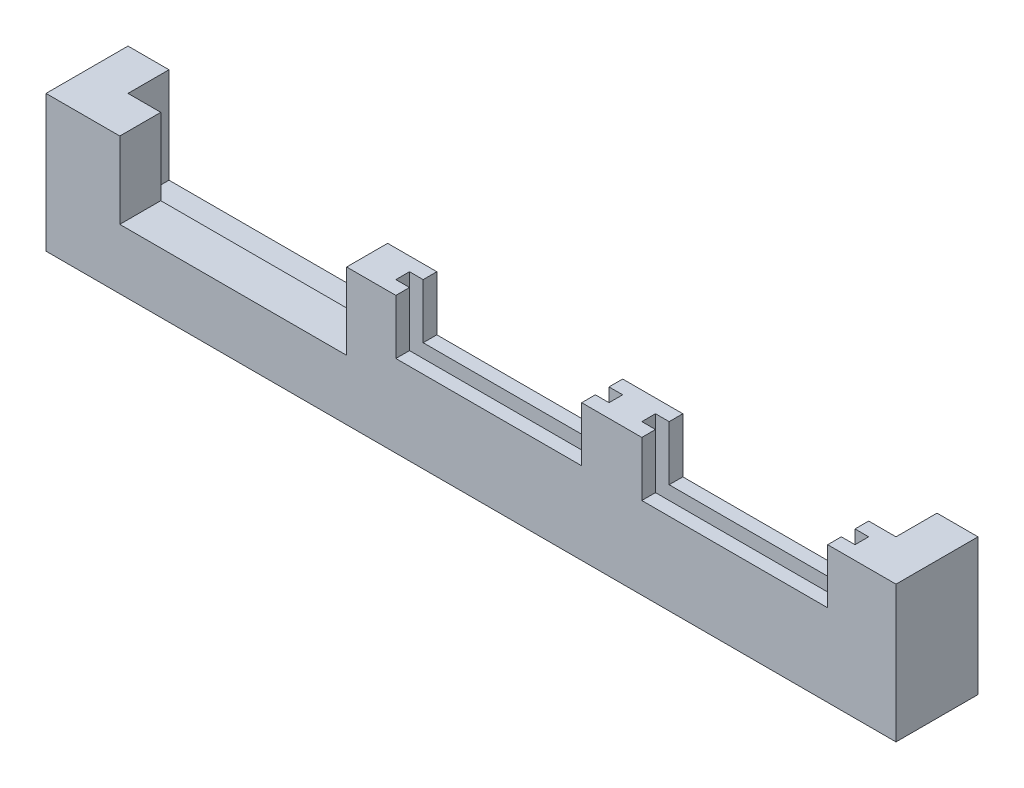
from build123d import *

# Parameters (mm, degrees)
BOSS_EXTRUDE1_DEPTH = 3
SKETCH4_W           = 15.6
SKETCH4_H           = 1
CUT_EXTRUDE1_DEPTH  = 5
BOSS_EXTRUDE3_DEPTH = 3


with BuildPart() as part:
    # Sketch1 → Boss-Extrude1 (new body)
    with BuildSketch(Plane.XY):
        Polygon((29.821727019, -20.842278002), (-26.378272981, -20.842278002), (-29.378272981, -20.842278002), (-29.378272981, -10.842278002), (-26.378272981, -10.842278002), (-23.978272981, -10.842278002), (-23.978272981, -16.442278002), (-7.378272981, -16.442278002), (-7.378272981, -10.842278002), (-3.778272981, -10.842278002), (-3.778272981, -14.842278002), (9.821727019, -14.842278002), (9.821727019, -10.842278002), (14.221727019, -10.842278002), (14.221727019, -14.842278002), (27.821727019, -14.842278002), (27.821727019, -10.842278002), (29.821727019, -10.842278002), (32.821727019, -10.842278002), (32.821727019, -20.842278002), align=None)
    extrude(amount=BOSS_EXTRUDE1_DEPTH)

    # Sketch4 → Cut-Extrude1 (cut)
    with BuildSketch(Plane(origin=(0, -10.842278002, 0), x_dir=(1, 0, 0), z_dir=(0, 1, 0))):
        with Locations((3.021727019, -1.5)):
            Rectangle(SKETCH4_W, SKETCH4_H)
        with Locations((21.021727019, -1.5)):
            Rectangle(SKETCH4_W, SKETCH4_H)
    extrude(amount=-CUT_EXTRUDE1_DEPTH, mode=Mode.SUBTRACT)

    # Sketch5 → Boss-Extrude3 (add)
    with BuildSketch(Plane(origin=(0, 0, 0), x_dir=(-1, 0, 0), z_dir=(0, 0, -1))):
        Polygon((-32.821727019, -10.842278002), (-32.821727019, -20.842278002), (29.378272981, -20.842278002), (29.378272981, -10.842278002), (26.378272981, -10.842278002), (26.378272981, -17.842278002), (-29.821727019, -17.842278002), (-29.821727019, -10.842278002), align=None)
    extrude(amount=BOSS_EXTRUDE3_DEPTH)


solid = part.part
